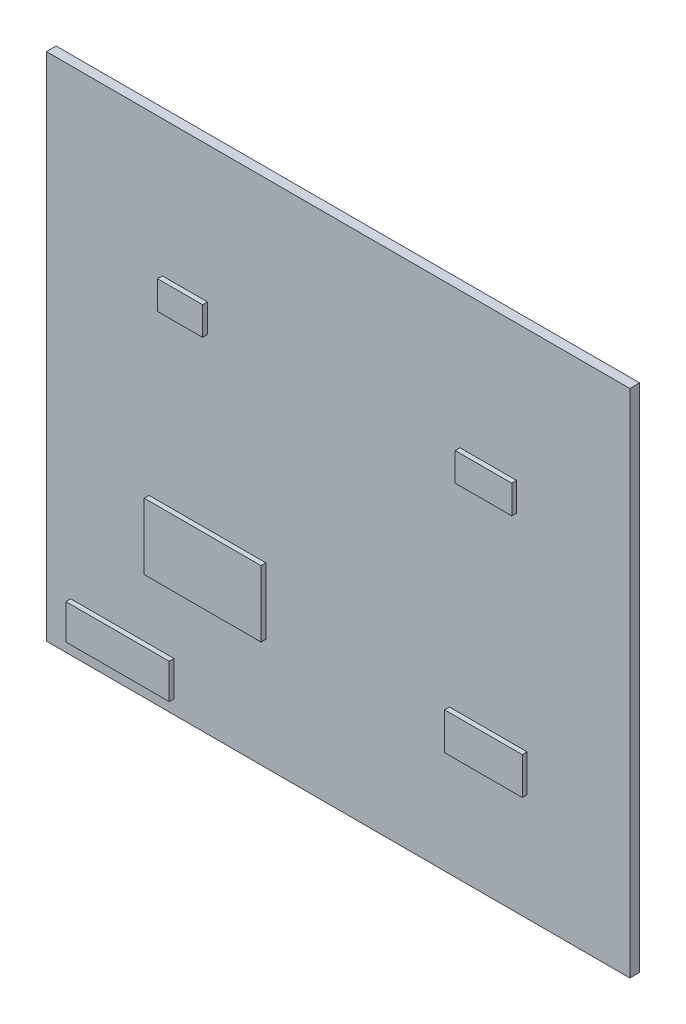
from build123d import *

# Parameters (mm, degrees)
SKETCH1_W           = 120
SKETCH1_H           = 105
BOSS_EXTRUDE1_DEPTH = 2
SKETCH2_W           = 24.020633768
SKETCH2_H           = 13.604733883
SKETCH2_W_2         = 15.976853837
SKETCH2_H_2         = 7.633913726
SKETCH2_W_3         = 9.287125415
SKETCH2_H_3         = 5.814380322
SKETCH2_W_4         = 11.648356386
SKETCH2_W_5         = 21.267599873
SKETCH2_H_4         = 7.189917071
BOSS_EXTRUDE2_DEPTH = 1


with BuildPart() as part:
    # Sketch1 → Boss-Extrude1 (new body)
    with BuildSketch(Plane.XY):
        Rectangle(SKETCH1_W, SKETCH1_H)
    extrude(amount=BOSS_EXTRUDE1_DEPTH)

    # Sketch2 → Boss-Extrude2 (add)
    with BuildSketch(Plane.XY.offset(2)):
        with Locations((-26.865959822, -22.784123417)):
            Rectangle(SKETCH2_W, SKETCH2_H)
        with Locations((30.883941206, -26.60108028)):
            Rectangle(SKETCH2_W_2, SKETCH2_H_2)
        with Locations((-31.509522529, 21.57302436)):
            Rectangle(SKETCH2_W_3, SKETCH2_H_3)
        with Locations((30.883941206, 21.57302436)):
            Rectangle(SKETCH2_W_4, SKETCH2_H_3)
        with Locations((-44.38112644, -46.052934011)):
            Rectangle(SKETCH2_W_5, SKETCH2_H_4)
    extrude(amount=BOSS_EXTRUDE2_DEPTH)


solid = part.part
